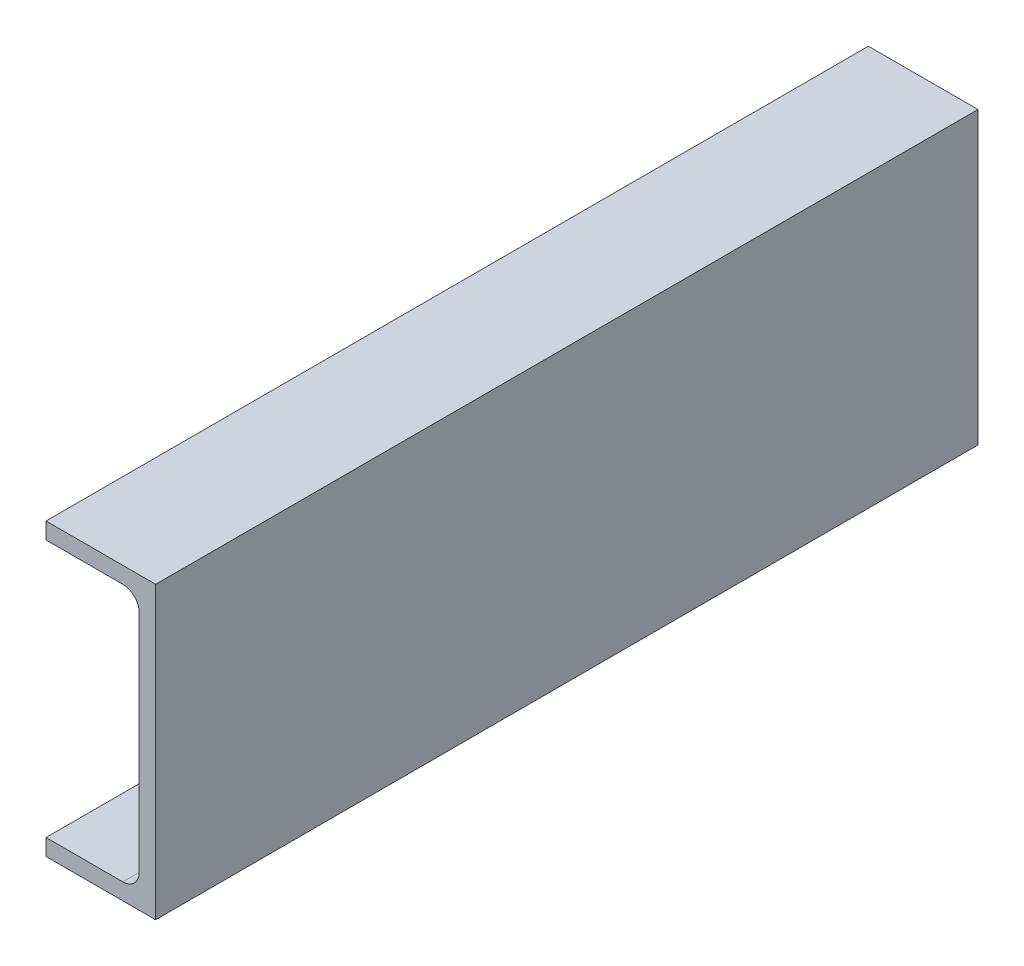
from build123d import *

# Parameters (mm, degrees)
EXTRUDE_1_DEPTH = 75
FILLET_1_R      = 3


with BuildPart() as part:
    # Эскиз1 → Вытянуть-Тонкостенный1 (new, symmetric)
    with BuildSketch(Plane.XY):
        Polygon((0, 0), (20, 0), (20, 53), (0, 53), (0, 50), (17, 50), (17, 3), (0, 3), align=None)
    extrude(amount=EXTRUDE_1_DEPTH, both=True)

    # Скругление1
    fillet_1_edges = [part.edges().sort_by_distance(p)[0] for p in [
        (17, 3, 0),
        (17, 50, 0),
    ]]
    fillet(fillet_1_edges, radius=FILLET_1_R)


solid = part.part
